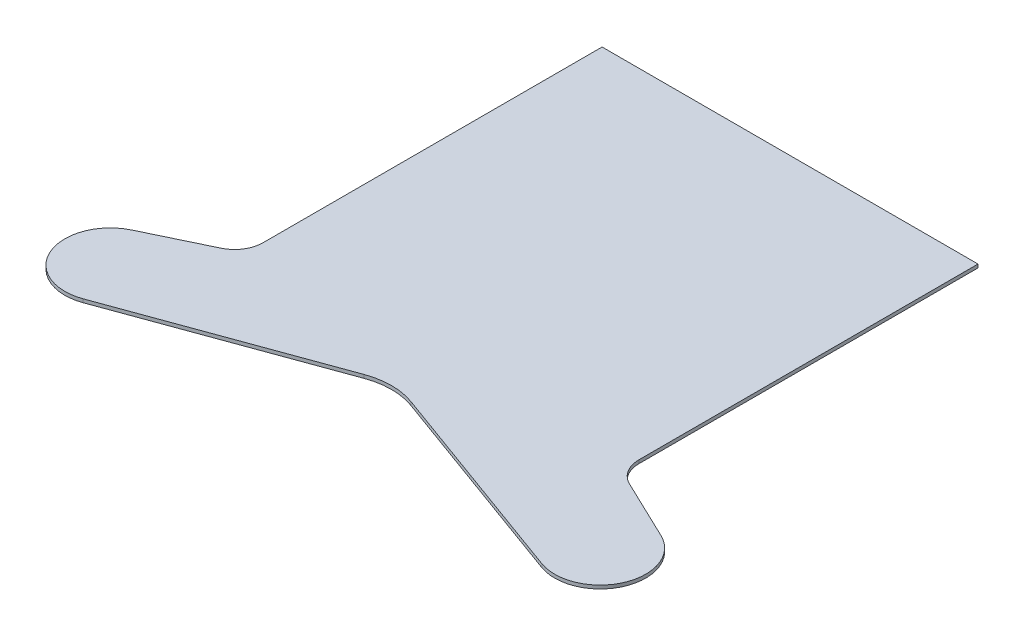
from build123d import *

# Parameters (mm, degrees)
BOSS_EXTRUDE1_DEPTH = 3


with BuildPart() as part:
    # Sketch3 → Boss-Extrude1 (new body)
    with BuildSketch(Plane(origin=(0, 0, 0), x_dir=(1, 0, 0), z_dir=(0, 1, 0))):
        with BuildLine():
            Line((-36.319194267, -89.236860887), (144.478790315, -23.431776084))
            ThreePointArc((144.478790315, -23.431776084), (165.000000077, -19.813332936), (185.52120983, -23.431776136))
            Line((185.52120983, -23.431776136), (366.319192052, -89.236860081))
            ThreePointArc((366.319192052, -89.236860081), (416.877444894, -67.142834059), (397.269838057, -15.569346002))
            Line((397.269838057, -15.569346002), (344.206351456, 9.829836443))
            ThreePointArc((344.206351456, 9.829836443), (333.847680817, 19.053826006), (330, 32.379717841))
            Line((330, 32.379717841), (330, 330))
            Line((330, 330), (0, 330))
            Line((0, 330), (0, 32.379717841))
            ThreePointArc((0, 32.379717841), (-3.847681031, 19.053825667), (-14.206352179, 9.829836096))
            Line((-14.206352179, 9.829836096), (-67.269835876, -15.569344958))
            ThreePointArc((-67.269835876, -15.569344958), (-86.877445819, -67.142831858), (-36.319194267, -89.236860887))
        make_face()
    extrude(amount=BOSS_EXTRUDE1_DEPTH)


solid = part.part
